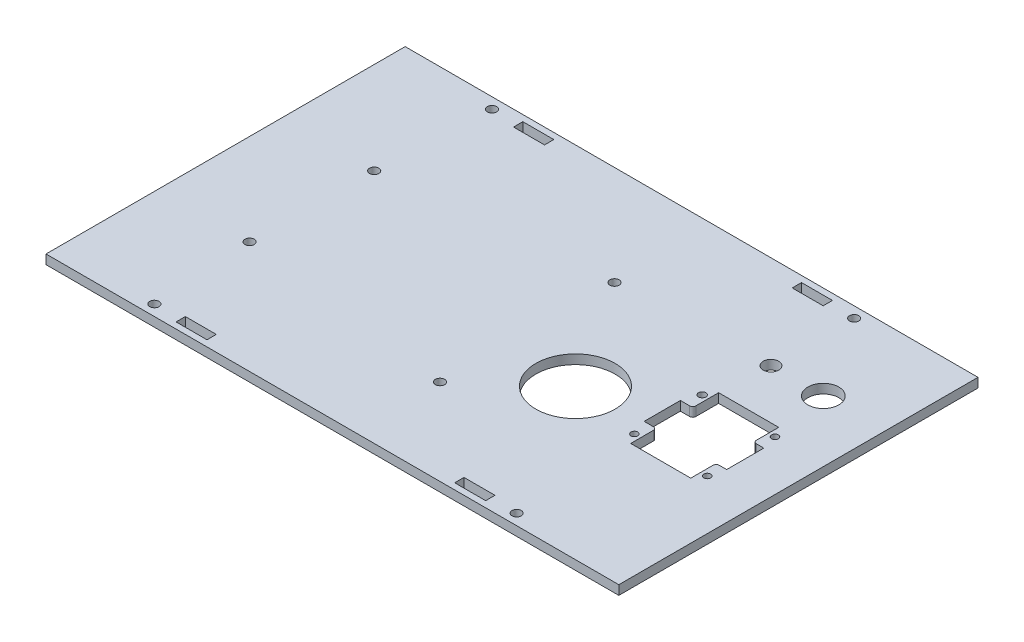
from build123d import *

# Parameters (mm, degrees)
SKETCH1_W           = 185
SKETCH1_H           = 116
BOSS_EXTRUDE1_DEPTH = 3
SKETCH8_R           = 1.5
CUT_EXTRUDE3_DEPTH  = 3
SKETCH10_R          = 1.2
SKETCH10_R_2        = 1.1
SKETCH10_R_3        = 2.5
SKETCH10_R_4        = 5
SKETCH10_R_5        = 12.80026957
CUT_EXTRUDE6_DEPTH  = 3
SKETCH11_W          = 10
SKETCH11_H          = 3
CUT_EXTRUDE7_DEPTH  = 3
SKETCH13_R          = 1.5
SKETCH13_R_2        = 1.506866353
CUT_EXTRUDE8_DEPTH  = 3


with BuildPart() as part:
    # Sketch1 → Boss-Extrude1 (new body)
    with BuildSketch(Plane(origin=(0, 0, 0), x_dir=(1, 0, 0), z_dir=(0, 1, 0))):
        Rectangle(SKETCH1_W, SKETCH1_H)
    extrude(amount=BOSS_EXTRUDE1_DEPTH)

    # Sketch8 → Cut-Extrude3 (cut)
    with BuildSketch(Plane(origin=(0, 3, 0), x_dir=(1, 0, 0), z_dir=(0, 1, 0))):
        with Locations(Location((-62.764720309, 18.264176016, 0), (0, 0, 270))):
            Circle(SKETCH8_R)
        with Locations(Location((-63.016694441, -21.735030339, 0), (0, 0, 270))):
            Circle(SKETCH8_R)
        with Locations(Location((7.284285639, 25.823062556, 0), (0, 0, 270))):
            Circle(SKETCH8_R)
        with Locations(Location((6.931521854, -30.175826341, 0), (0, 0, 270))):
            Circle(SKETCH8_R)
    extrude(amount=-CUT_EXTRUDE3_DEPTH, mode=Mode.SUBTRACT)

    # Sketch10 → Cut-Extrude6 (cut)
    with BuildSketch(Plane(origin=(0, 3, 0), x_dir=(1, 0, 0), z_dir=(0, 1, 0))):
        with Locations(Location((52.862616564, 8.568904476, 0), (0, 0, 270))):
            Circle(SKETCH10_R)
        with Locations(Location((52.862616564, -13.331095524, 0), (0, 0, 270))):
            Circle(SKETCH10_R_2)
        with Locations(Location((76.362616564, -13.331095524, 0), (0, 0, 270))):
            Circle(SKETCH10_R_2)
        with Locations(Location((76.362616564, 8.568904476, 0), (0, 0, 270))):
            Circle(SKETCH10_R_2)
        with Locations(Location((55.812578484, 27.817001132, 0), (0, 0, 270))):
            Circle(SKETCH10_R_3)
        with Locations(Location((72.735814959, 27.817001132, 0), (0, 0, 270))):
            Circle(SKETCH10_R_4)
        with Locations(Location((30, -9.5, 0), (0, 0, 270))):
            Circle(SKETCH10_R_5)
        with BuildLine():
            Line((50.912616564, -8.231095524), (53.912616564, -8.231095524))
            ThreePointArc((53.912616564, -8.231095524), (54.619723345, -8.523988743), (54.912616564, -9.231095524))
            Line((54.912616564, -9.231095524), (54.912616564, -16.581095524))
            Line((54.912616564, -16.581095524), (74.312616564, -16.581095524))
            Line((74.312616564, -16.581095524), (74.312616564, -9.381095524))
            ThreePointArc((74.312616564, -9.381095524), (74.605509783, -8.673988743), (75.312616564, -8.381095524))
            Line((75.312616564, -8.381095524), (77.712616564, -8.381095524))
            Line((77.712616564, -8.381095524), (77.712616564, 3.618904476))
            Line((77.712616564, 3.618904476), (75.312616564, 3.618904476))
            ThreePointArc((75.312616564, 3.618904476), (74.605509783, 3.911797695), (74.312616564, 4.618904476))
            Line((74.312616564, 4.618904476), (74.312616564, 11.818904476))
            Line((74.312616564, 11.818904476), (54.912616564, 11.818904476))
            Line((54.912616564, 11.818904476), (54.912616564, 4.473317322))
            ThreePointArc((54.912616564, 4.473317322), (54.620243085, 3.766730663), (53.914087151, 3.473318403))
            Line((53.914087151, 3.473318403), (50.912616564, 3.468904476))
            Line((50.912616564, 3.468904476), (50.912616564, -8.231095524))
        make_face()
    extrude(amount=-CUT_EXTRUDE6_DEPTH, mode=Mode.SUBTRACT)

    # Sketch11 → Cut-Extrude7 (cut)
    with BuildSketch(Plane(origin=(0, 3, 0), x_dir=(1, 0, 0), z_dir=(0, 1, 0))):
        with Locations((-47.5, 54.5)):
            Rectangle(SKETCH11_W, SKETCH11_H)
        with Locations((42.5, 54.5)):
            Rectangle(SKETCH11_W, SKETCH11_H)
        with Locations((-47.5, -54.5)):
            Rectangle(SKETCH11_W, SKETCH11_H)
        with Locations((42.5, -54.5)):
            Rectangle(SKETCH11_W, SKETCH11_H)
    extrude(amount=-CUT_EXTRUDE7_DEPTH, mode=Mode.SUBTRACT)

    # Sketch13 → Cut-Extrude8 (cut)
    with BuildSketch(Plane.XZ):
        with Locations(Location((56, -54.5, 0), (0, 0, 270))):
            Circle(SKETCH13_R)
        with Locations(Location((-60.935816723, -54.506866353, 0), (0, 0, 270))):
            Circle(SKETCH13_R_2)
        with Locations(Location((-61, 54.5, 0), (0, 0, 270))):
            Circle(SKETCH13_R)
        with Locations(Location((56, 54.5, 0), (0, 0, 270))):
            Circle(SKETCH13_R)
    extrude(amount=-CUT_EXTRUDE8_DEPTH, mode=Mode.SUBTRACT)


solid = part.part
